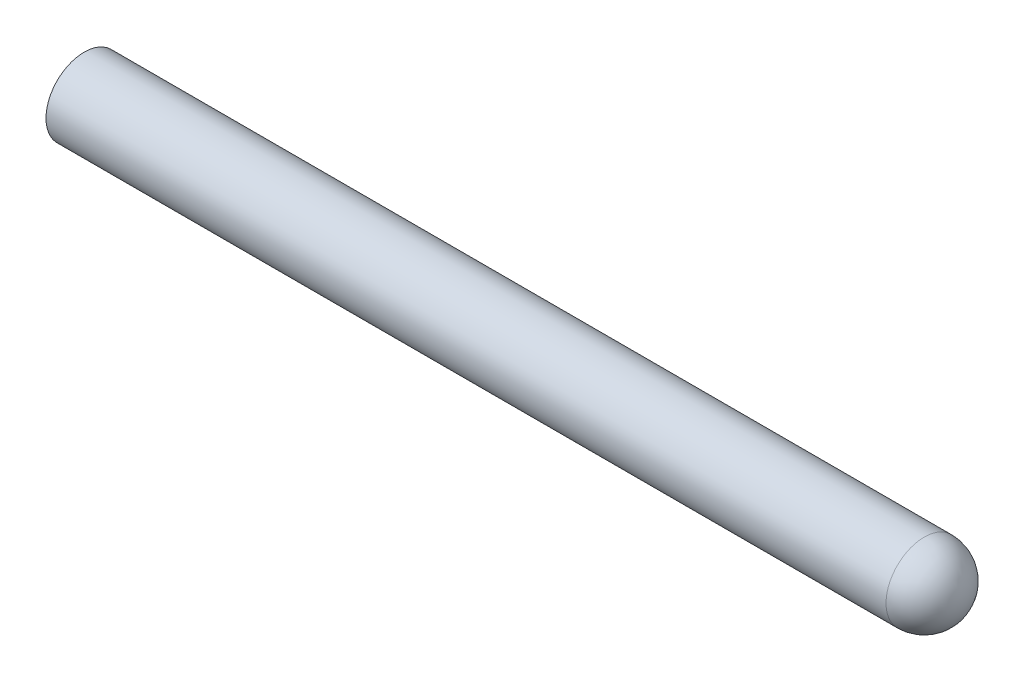
from build123d import *

# Parameters (mm, degrees)
SKETCH1_R           = 19.05
SKETCH1_R_2         = 12.7
BOSS_EXTRUDE1_DEPTH = 355.6
BOSS_EXTRUDE2_START = 63.5
SKETCH4_R           = 19.05
SKETCH4_R_2         = 9.525
BOSS_EXTRUDE2_DEPTH = 63.5


with BuildPart() as part:
    # Sketch1 → Boss-Extrude1 (new body)
    with BuildSketch(Plane(origin=(0, 0, 0), x_dir=(0, 0, -1), z_dir=(1, 0, 0))):
        Circle(SKETCH1_R)
        Circle(SKETCH1_R_2, mode=Mode.SUBTRACT)
    extrude(amount=BOSS_EXTRUDE1_DEPTH)

    # Sketch3 → Revolve1 (revolve)
    with BuildSketch(Plane.XY):
        with BuildLine():
            Line((355.6, 19.05), (355.6, 0))
            Line((355.6, 0), (374.65, 0))
            ThreePointArc((374.65, 0), (369.070384182, 13.470384182), (355.6, 19.05))
        make_face()
    revolve(axis=Axis((355.6, 0, 0), (1, 0, 0)))

    # Sketch4 → Boss-Extrude2 (add)
    with BuildSketch(Plane.ZY.offset(BOSS_EXTRUDE2_START)):
        Circle(SKETCH4_R)
        Circle(SKETCH4_R_2, mode=Mode.SUBTRACT)
    extrude(amount=-BOSS_EXTRUDE2_DEPTH)


solid = part.part
